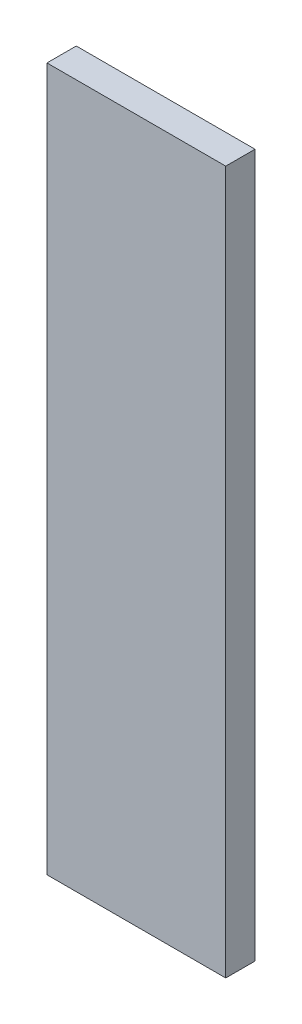
from build123d import *

# Parameters (mm, degrees)
SKETCH1_W           = 38.747662889
SKETCH1_H           = 152.4
BOSS_EXTRUDE1_DEPTH = 6.35


with BuildPart() as part:
    # Sketch1 → Boss-Extrude1 (new body)
    with BuildSketch(Plane.XY):
        with Locations((-448.538229097, 134.777135462)):
            Rectangle(SKETCH1_W, SKETCH1_H)
    extrude(amount=BOSS_EXTRUDE1_DEPTH)


solid = part.part
